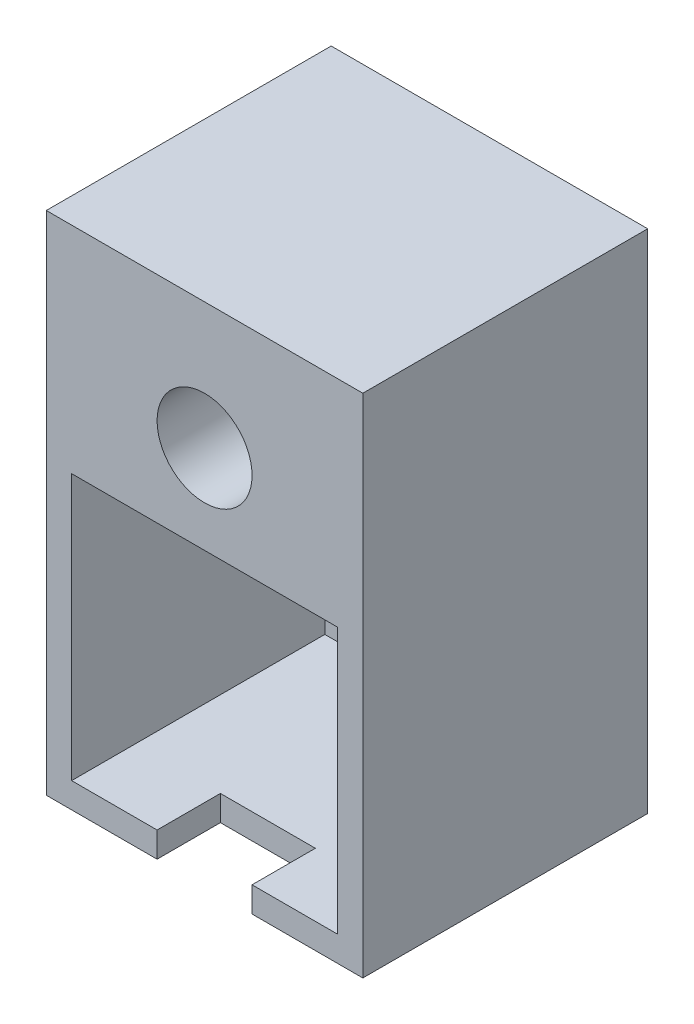
from build123d import *

# Parameters (mm, degrees)
SKETCH1_W           = 50
SKETCH1_H           = 80
BOSS_EXTRUDE1_DEPTH = 45
SKETCH5_W           = 42
SKETCH5_H           = 42
CUT_EXTRUDE1_DEPTH  = 40
SKETCH6_R           = 1.5
CUT_EXTRUDE2_DEPTH  = 40
SKETCH7_W           = 15
SKETCH7_H           = 41.689626702
CUT_EXTRUDE3_DEPTH  = 10
SKETCH8_R           = 11
CUT_EXTRUDE4_DEPTH  = 2
SKETCH9_R           = 2
CUT_EXTRUDE5_DEPTH  = 10
SKETCH2_R           = 2.5
CUT_EXTRUDE6_DEPTH  = 10
SKETCH10_R          = 7.5
CUT_EXTRUDE7_DEPTH  = 48


with BuildPart() as part:
    # Sketch1 → Boss-Extrude1 (new body)
    with BuildSketch(Plane.XY):
        Rectangle(SKETCH1_W, SKETCH1_H)
    extrude(amount=BOSS_EXTRUDE1_DEPTH)

    # Sketch5 → Cut-Extrude1 (cut)
    with BuildSketch(Plane.XY.offset(45)):
        with Locations((0, -15)):
            Rectangle(SKETCH5_W, SKETCH5_H)
    extrude(amount=-CUT_EXTRUDE1_DEPTH, mode=Mode.SUBTRACT)

    # Sketch6 → Cut-Extrude2 (cut)
    with BuildSketch(Plane.XY.offset(5)):
        with Locations((15.5, -30.5)):
            Circle(SKETCH6_R)
        with Locations((15.5, 0.5)):
            Circle(SKETCH6_R)
        with Locations((-15.5, -30.5)):
            Circle(SKETCH6_R)
        with Locations((-15.5, 0.5)):
            Circle(SKETCH6_R)
    extrude(amount=-CUT_EXTRUDE2_DEPTH, mode=Mode.SUBTRACT)

    # Sketch7 → Cut-Extrude3 (cut)
    with BuildSketch(Plane.XY.offset(45)):
        with Locations((0, -40)):
            Rectangle(SKETCH7_W, SKETCH7_H)
    extrude(amount=-CUT_EXTRUDE3_DEPTH, mode=Mode.SUBTRACT)

    # Sketch8 → Cut-Extrude4 (cut)
    with BuildSketch(Plane.XY.offset(5)):
        with Locations((0, -15)):
            Circle(SKETCH8_R)
    extrude(amount=-CUT_EXTRUDE4_DEPTH, mode=Mode.SUBTRACT)

    # Sketch9 → Cut-Extrude5 (cut)
    with BuildSketch(Plane.XY.offset(3)):
        with Locations((0, -15)):
            Circle(SKETCH9_R)
    extrude(amount=-CUT_EXTRUDE5_DEPTH, mode=Mode.SUBTRACT)

    # Sketch2 → Cut-Extrude6 (cut)
    with BuildSketch(Plane(origin=(0, 0, 0), x_dir=(-1, 0, 0), z_dir=(0, 0, -1))):
        with Locations((0, 20)):
            Circle(SKETCH2_R)
    extrude(amount=-CUT_EXTRUDE6_DEPTH, mode=Mode.SUBTRACT)

    # Sketch10 → Cut-Extrude7 (cut)
    with BuildSketch(Plane(origin=(0, 0, 0), x_dir=(-1, 0, 0), z_dir=(0, 0, -1))):
        with Locations((0, 20)):
            Circle(SKETCH10_R)
    extrude(amount=-CUT_EXTRUDE7_DEPTH, mode=Mode.SUBTRACT)


solid = part.part
